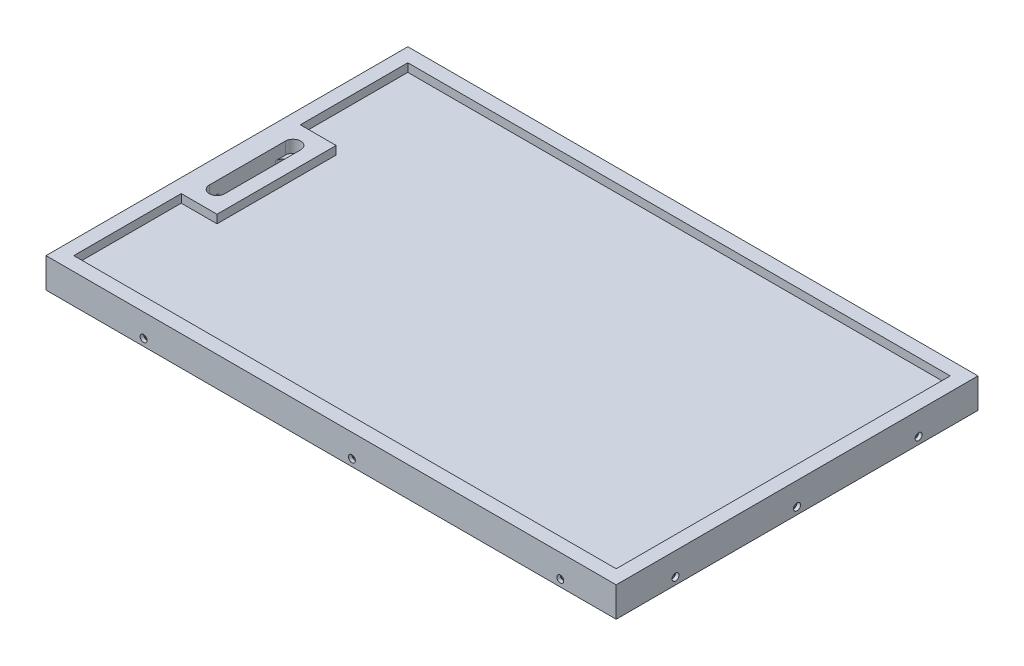
from build123d import *

# Parameters (mm, degrees)
SKETCH_1_W               = 164.2
SKETCH_1_H               = 104.2
EXTRUDE_1_DEPTH          = 8
SKETCH_2_R               = 0.3
CUT_EXTRUDE_1_DEPTH      = 98.564440243
CUT_EXTRUDE_2_DEPTH      = 5.9
SKETCH_5_W               = 148.4
SKETCH_5_H               = 100.2
CUT_EXTRUDE_5_DEPTH      = 1.2
SKETCH_6_W               = 164.2
SKETCH_6_H               = 104.2
SKETCH_6_W_2             = 148.4
SKETCH_6_H_2             = 100.2
EXTRUDE_2_DEPTH          = 3
CUT_EXTRUDE_6_DEPTH      = 132.336400133
CUT_EXTRUDE_6_DEPTH_BACK = 132.336400133
SKETCH_7_R               = 0.75
CUT_EXTRUDE_START        = -2
SKETCH_7_3_R             = 1
SKETCH_7_3_R_2           = 0.75
CUT_EXTRUDE_7_DEPTH      = 1
CUT_EXTRUDE_START_2      = 101.2
SKETCH_7_4_R             = 1
SKETCH_7_4_R_2           = 0.75
CUT_EXTRUDE_8_DEPTH      = 1
SKETCH_8_R               = 0.75
CUT_EXTRUDE_9_DEPTH      = 171.644953046
CUT_EXTRUDE_START_3      = -0.9
SKETCH_8_3_R             = 1
SKETCH_8_3_R_2           = 0.75
CUT_EXTRUDE_10_DEPTH     = 1
SKETCH_3_W               = 145.9
SKETCH_3_H               = 96.2
SKETCH_3_W_2             = 10.3
SKETCH_3_H_2             = 30.95
CUT_EXTRUDE_11_DEPTH     = 4.8
SKETCH_9_W               = 164.2
SKETCH_9_H               = 104.2
CUT_EXTRUDE_12_DEPTH     = 2.4


with BuildPart() as part:
    # 草图1 → 凸台-拉伸1 (new body)
    with BuildSketch(Plane(origin=(0, 0, 0), x_dir=(1, 0, 0), z_dir=(0, 1, 0))):
        Rectangle(SKETCH_1_W, SKETCH_1_H)
    extrude(amount=EXTRUDE_1_DEPTH)

    # 草图2 → 切除-拉伸1 (cut, through all)
    with BuildSketch(Plane(origin=(0, 8, 0), x_dir=(1, 0, 0), z_dir=(0, 1, 0))):
        with Locations(Location((-74, 11.5, 0), (0, 0, 270))):
            Circle(SKETCH_2_R)
        with Locations(Location((-74, -11.5, 0), (0, 0, 270))):
            Circle(SKETCH_2_R)
        with BuildLine():
            Line((-76.2, -8.05), (-76.2, 8.05))
            ThreePointArc((-76.2, 8.05), (-74, 10.25), (-71.8, 8.05))
            Line((-71.8, 8.05), (-71.8, -8.05))
            ThreePointArc((-71.8, -8.05), (-74, -10.25), (-76.2, -8.05))
        make_face()
    extrude(amount=-CUT_EXTRUDE_1_DEPTH, mode=Mode.SUBTRACT)

    # 草图2<3> → 切除-拉伸2 (cut)
    with BuildSketch(Plane(origin=(0, 8, 0), x_dir=(1, 0, 0), z_dir=(0, 1, 0))):
        with BuildLine():
            Line((-71.8, 10.95), (-71.8, -10.95))
            ThreePointArc((-71.8, -10.95), (-74, -13.15), (-76.2, -10.95))
            Line((-76.2, -10.95), (-76.2, 10.95))
            ThreePointArc((-76.2, 10.95), (-74, 13.15), (-71.8, 10.95))
        make_face()
    extrude(amount=-CUT_EXTRUDE_2_DEPTH, mode=Mode.SUBTRACT)

    # 草图5 → 切除-拉伸5 (cut)
    with BuildSketch(Plane.XZ):
        with Locations((6, 0)):
            Rectangle(SKETCH_5_W, SKETCH_5_H)
    extrude(amount=-CUT_EXTRUDE_5_DEPTH, mode=Mode.SUBTRACT)

    # 草图6 → 凸台-拉伸2 (add)
    with BuildSketch(Plane.XZ):
        Rectangle(SKETCH_6_W, SKETCH_6_H)
        with BuildLine():
            ThreePointArc((-71.8, -10.95), (-74.1, -13.25), (-76.4, -10.95))
            Line((-76.4, -10.95), (-76.4, -5.229910312))
            ThreePointArc((-76.4, -5.229910312), (-77.793738469, -4.481131324), (-78.35, -3))
            Line((-78.35, -3), (-78.35, 3))
            ThreePointArc((-78.35, 3), (-77.793738469, 4.481131324), (-76.4, 5.229910312))
            Line((-76.4, 5.229910312), (-76.4, 10.95))
            ThreePointArc((-76.4, 10.95), (-74.1, 13.25), (-71.8, 10.95))
            Line((-71.8, 10.95), (-71.8, 8.05))
            Line((-71.8, 8.05), (-71.8, 2.229910312))
            ThreePointArc((-71.8, 2.229910312), (-70.406261531, 1.481131324), (-69.85, 0))
            ThreePointArc((-69.85, 0), (-70.406261531, -1.481131324), (-71.8, -2.229910312))
            Line((-71.8, -2.229910312), (-71.8, -8.05))
            Line((-71.8, -8.05), (-71.8, -10.95))
        make_face(mode=Mode.SUBTRACT)
        with Locations((6, 0)):
            Rectangle(SKETCH_6_W_2, SKETCH_6_H_2, mode=Mode.SUBTRACT)
    extrude(amount=EXTRUDE_2_DEPTH)

    # 草图7 → 切除-拉伸6 (cut, two sides: drawn at the far end of the back side and taken through both)
    with BuildSketch(Plane.XY.offset(-50.1).offset(-CUT_EXTRUDE_6_DEPTH_BACK)):
        with Locations((6, -1)):
            Circle(SKETCH_7_R)
        with Locations((-54, -1)):
            Circle(SKETCH_7_R)
        with Locations((66, -1)):
            Circle(SKETCH_7_R)
    extrude(amount=CUT_EXTRUDE_6_DEPTH + CUT_EXTRUDE_6_DEPTH_BACK, mode=Mode.SUBTRACT)

    # 草图7<3> → 切除-拉伸7 (cut)
    # profile 1 of 3: a face of its own
    with BuildSketch(Plane.XY.offset(-50.1).offset(CUT_EXTRUDE_START)):
        with Locations((6, -1)):
            Circle(SKETCH_7_3_R)
        with Locations((6, -1)):
            Circle(SKETCH_7_3_R_2, mode=Mode.SUBTRACT)
    # profile 2 of 3: a face of its own
    with BuildSketch(Plane.XY.offset(-50.1).offset(CUT_EXTRUDE_START)):
        with Locations((66, -1)):
            Circle(SKETCH_7_3_R)
        with Locations((66, -1)):
            Circle(SKETCH_7_3_R_2, mode=Mode.SUBTRACT)
    # profile 3 of 3: a face of its own
    with BuildSketch(Plane.XY.offset(-50.1).offset(CUT_EXTRUDE_START)):
        with Locations((-54, -1)):
            Circle(SKETCH_7_3_R)
        with Locations((-54, -1)):
            Circle(SKETCH_7_3_R_2, mode=Mode.SUBTRACT)
    extrude(amount=CUT_EXTRUDE_7_DEPTH, mode=Mode.SUBTRACT)

    # 草图7<4> → 切除-拉伸8 (cut)
    # profile 1 of 3: a face of its own
    with BuildSketch(Plane.XY.offset(-50.1).offset(CUT_EXTRUDE_START_2)):
        with Locations((6, -1)):
            Circle(SKETCH_7_4_R)
        with Locations((6, -1)):
            Circle(SKETCH_7_4_R_2, mode=Mode.SUBTRACT)
    # profile 2 of 3: a face of its own
    with BuildSketch(Plane.XY.offset(-50.1).offset(CUT_EXTRUDE_START_2)):
        with Locations((66, -1)):
            Circle(SKETCH_7_4_R)
        with Locations((66, -1)):
            Circle(SKETCH_7_4_R_2, mode=Mode.SUBTRACT)
    # profile 3 of 3: a face of its own
    with BuildSketch(Plane.XY.offset(-50.1).offset(CUT_EXTRUDE_START_2)):
        with Locations((-54, -1)):
            Circle(SKETCH_7_4_R)
        with Locations((-54, -1)):
            Circle(SKETCH_7_4_R_2, mode=Mode.SUBTRACT)
    extrude(amount=CUT_EXTRUDE_8_DEPTH, mode=Mode.SUBTRACT)

    # 草图8 → 切除-拉伸9 (cut, through all)
    with BuildSketch(Plane.ZY.offset(-80.2)):
        with Locations((-35, -1)):
            Circle(SKETCH_8_R)
        with Locations((0, -1)):
            Circle(SKETCH_8_R)
        with Locations((35, -1)):
            Circle(SKETCH_8_R)
    extrude(amount=-CUT_EXTRUDE_9_DEPTH, mode=Mode.SUBTRACT)

    # 草图8<3> → 切除-拉伸10 (cut)
    # profile 1 of 3: a face of its own
    with BuildSketch(Plane.ZY.offset(-80.2).offset(CUT_EXTRUDE_START_3)):
        with Locations((0, -1)):
            Circle(SKETCH_8_3_R)
        with Locations((0, -1)):
            Circle(SKETCH_8_3_R_2, mode=Mode.SUBTRACT)
    # profile 2 of 3: a face of its own
    with BuildSketch(Plane.ZY.offset(-80.2).offset(CUT_EXTRUDE_START_3)):
        with Locations((-35, -1)):
            Circle(SKETCH_8_3_R)
        with Locations((-35, -1)):
            Circle(SKETCH_8_3_R_2, mode=Mode.SUBTRACT)
    # profile 3 of 3: a face of its own
    with BuildSketch(Plane.ZY.offset(-80.2).offset(CUT_EXTRUDE_START_3)):
        with Locations((35, -1)):
            Circle(SKETCH_8_3_R)
        with Locations((35, -1)):
            Circle(SKETCH_8_3_R_2, mode=Mode.SUBTRACT)
    extrude(amount=-CUT_EXTRUDE_10_DEPTH, mode=Mode.SUBTRACT)

    # 草图3 → 切除-拉伸11 (cut)
    with BuildSketch(Plane(origin=(0, 8, 0), x_dir=(1, 0, 0), z_dir=(0, 1, 0))):
        with Locations((5.15, 0)):
            Rectangle(SKETCH_3_W, SKETCH_3_H)
        with Locations((-72.95, 32.625)):
            Rectangle(SKETCH_3_W_2, SKETCH_3_H_2)
        with Locations((-72.95, -32.625)):
            Rectangle(SKETCH_3_W_2, SKETCH_3_H_2)
    extrude(amount=-CUT_EXTRUDE_11_DEPTH, mode=Mode.SUBTRACT)

    # 草图9 → 切除-拉伸12 (cut)
    with BuildSketch(Plane(origin=(0, 8, 0), x_dir=(1, 0, 0), z_dir=(0, 1, 0))):
        Rectangle(SKETCH_9_W, SKETCH_9_H)
    extrude(amount=-CUT_EXTRUDE_12_DEPTH, mode=Mode.SUBTRACT)


solid = part.part
